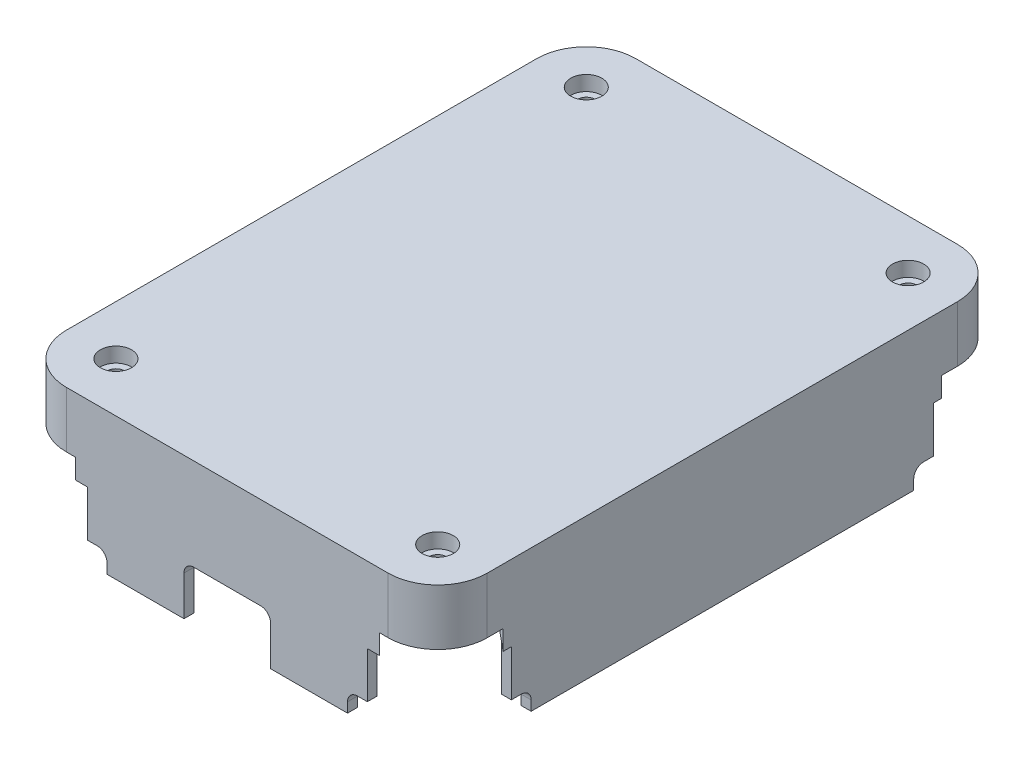
from build123d import *

# Parameters (mm, degrees)
SKETCH1_W               = 107.95
SKETCH1_H               = 146.05
BOSS_EXTRUDE1_DEPTH     = 2.54
SKETCH13_W              = 25.4
SKETCH13_H              = 25.4
BOSS_EXTRUDE4_DEPTH     = 19.431
SKETCH2_R               = 3.302
CUT_EXTRUDE1_DEPTH      = 93.862882849
FILLET1_R               = 12.7
CUT_EXTRUDE13_DEPTH     = 5.08
SKETCH15_R              = 6.35
BOSS_EXTRUDE5_DEPTH     = 11.811
SKETCH23_R              = 2.25
CUT_EXTRUDE14_DEPTH     = 92.934228941
SKETCH24_R              = 4
CUT_EXTRUDE15_DEPTH     = 3.81
MIRROR2_COPY_1_SKETCH_R = 2.25
MIRROR2_COPY_1_DEPTH    = 92.934228941
MIRROR2_COPY_2_SKETCH_R = 4
MIRROR2_COPY_2_DEPTH    = 3.81
FILLET3_R               = 12.7
FILLET4_R               = 1.016
SKETCH27_W              = 71.841582164
SKETCH27_H              = 2.54
SKETCH27_W_2            = 2.54
SKETCH27_H_2            = 108.293882364
BOSS_EXTRUDE6_DEPTH     = 33.782
CUT_EXTRUDE16_DEPTH     = 41.656
CUT_EXTRUDE17_DEPTH     = 136.296492227
CUT_EXTRUDE18_DEPTH     = 160.8849299
CUT_EXTRUDE19_REACH     = 161.885
SKETCH31_W              = 22.225
SKETCH31_H              = 12.7
FILLET5_R               = 2.54


with BuildPart() as part:
    # Sketch1 → Boss-Extrude1 (new body)
    with BuildSketch(Plane(origin=(0, 0, 0), x_dir=(1, 0, 0), z_dir=(0, 1, 0))):
        Rectangle(SKETCH1_W, SKETCH1_H)
    extrude(amount=-BOSS_EXTRUDE1_DEPTH)

    # Sketch13 → Boss-Extrude4 (add)
    with BuildSketch(Plane(origin=(0, 0, 0), x_dir=(1, 0, 0), z_dir=(0, 1, 0))):
        with Locations((41.275, -60.325)):
            Rectangle(SKETCH13_W, SKETCH13_H)
        with Locations((-41.275, -60.325)):
            Rectangle(SKETCH13_W, SKETCH13_H)
        with Locations((-41.275, 60.325)):
            Rectangle(SKETCH13_W, SKETCH13_H)
        with Locations((41.275, 60.325)):
            Rectangle(SKETCH13_W, SKETCH13_H)
    extrude(amount=-BOSS_EXTRUDE4_DEPTH)

    # Sketch2 → Cut-Extrude1 (cut, through all)
    with BuildSketch(Plane(origin=(0, 0, 0), x_dir=(1, 0, 0), z_dir=(0, 1, 0))):
        with Locations(Location((-41.275, 60.325, 0), (0, 0, 270))):
            Circle(SKETCH2_R)
        with Locations(Location((41.275, 60.325, 0), (0, 0, 90))):
            Circle(SKETCH2_R)
        with Locations(Location((41.275, -60.325, 0), (0, 0, 270))):
            Circle(SKETCH2_R)
        with Locations(Location((-41.275, -60.325, 0), (0, 0, 90))):
            Circle(SKETCH2_R)
    extrude(amount=-CUT_EXTRUDE1_DEPTH, mode=Mode.SUBTRACT)

    # Fillet1
    fillet1_edges = [part.edges().sort_by_distance(p)[0] for p in [
        (53.975, -9.7155, 73.025),
        (-53.975, -9.7155, 73.025),
        (-53.975, -9.7155, -73.025),
        (53.975, -9.7155, -73.025),
    ]]
    fillet(fillet1_edges, radius=FILLET1_R)

    # Sketch14 → Cut-Extrude13 (cut)
    with BuildSketch(Plane.XZ.offset(19.431)):
        Polygon((20.692003582, -28.674172721), (6.35, -45.983487389), (139.336989519, -156.172707277), (153.678993101, -138.863392609), align=None)
        Polygon((-20.692003582, -28.674172721), (-6.35, -45.983487389), (-139.336989519, -156.172707277), (-153.678993101, -138.863392609), align=None)
        Polygon((-153.678993101, 138.863392609), (-20.692003582, 28.674172721), (-6.35, 45.983487389), (-139.336989519, 156.172707277), align=None)
        Polygon((20.692003582, 28.674172721), (6.35, 45.983487389), (139.336989519, 156.172707277), (153.678993101, 138.863392609), align=None)
    extrude(amount=-CUT_EXTRUDE13_DEPTH, mode=Mode.SUBTRACT)

    # Sketch15 → Boss-Extrude5 (add)
    with BuildSketch(Plane(origin=(0, 0, 0), x_dir=(1, 0, 0), z_dir=(0, 1, 0))):
        with Locations((-41.275, 60.325)):
            Circle(SKETCH15_R)
        with Locations((41.275, 60.325)):
            Circle(SKETCH15_R)
        with Locations((-41.275, -60.325)):
            Circle(SKETCH15_R)
        with Locations((41.275, -60.325)):
            Circle(SKETCH15_R)
    extrude(amount=-BOSS_EXTRUDE5_DEPTH)

    # Sketch23 → Cut-Extrude14 (cut, through all)
    with BuildSketch(Plane.XZ.offset(14.351)):
        with Locations(Location((-41.275, -60.325, 0), (0, 0, 270))):
            Circle(SKETCH23_R)
    cut_extrude14 = extrude(amount=-CUT_EXTRUDE14_DEPTH, mode=Mode.SUBTRACT)

    # Sketch24 → Cut-Extrude15 (cut)
    with BuildSketch(Plane(origin=(0, 0, 0), x_dir=(1, 0, 0), z_dir=(0, 1, 0))):
        with Locations(Location((-41.275, 60.325, 0), (0, 0, 270))):
            Circle(SKETCH24_R)
    cut_extrude15 = extrude(amount=-CUT_EXTRUDE15_DEPTH, mode=Mode.SUBTRACT)

    # Mirror1: Cut-Extrude14, Cut-Extrude15 across plane
    add(cut_extrude14.mirror(Plane.XY), mode=Mode.SUBTRACT)
    add(cut_extrude15.mirror(Plane.XY), mode=Mode.SUBTRACT)

    # Mirror2: Cut-Extrude14, Cut-Extrude15 across plane
    add(cut_extrude14.mirror(Plane(origin=(0, 0, 0), x_dir=(0, 0, 1), z_dir=(1, 0, 0))), mode=Mode.SUBTRACT)
    add(cut_extrude15.mirror(Plane(origin=(0, 0, 0), x_dir=(0, 0, 1), z_dir=(1, 0, 0))), mode=Mode.SUBTRACT)

    # Mirror2 copy 1 sketch → Mirror2 copy 1 (cut, through all)
    with BuildSketch(Plane(origin=(0, -14.351, 0), x_dir=(-1, 0, 0), z_dir=(0, -1, 0))):
        with Locations(Location((-41.275, -60.325, 0), (0, 0, 270))):
            Circle(MIRROR2_COPY_1_SKETCH_R)
    extrude(amount=-MIRROR2_COPY_1_DEPTH, mode=Mode.SUBTRACT)

    # Mirror2 copy 2 sketch → Mirror2 copy 2 (cut)
    with BuildSketch(Plane(origin=(0, 0, 0), x_dir=(-1, 0, 0), z_dir=(0, 1, 0))):
        with Locations(Location((-41.275, 60.325, 0), (0, 0, 270))):
            Circle(MIRROR2_COPY_2_SKETCH_R)
    extrude(amount=-MIRROR2_COPY_2_DEPTH, mode=Mode.SUBTRACT)

    # Fillet3
    fillet3_edges = [part.edges().sort_by_distance(p)[0] for p in [
        (28.575, -8.4455, -47.625),
        (-28.575, -8.4455, -47.625),
        (-28.575, -8.4455, 47.625),
        (28.575, -8.4455, 47.625),
    ]]
    fillet(fillet3_edges, radius=FILLET3_R)

    # Fillet4
    fillet4_edges = [part.edges().sort_by_distance(p)[0] for p in [
        (41.275, -14.351, -57.023),
        (-41.275, -14.351, -63.627),
        (-41.275, -14.351, 63.627),
        (41.275, -14.351, 57.023),
    ]]
    fillet(fillet4_edges, radius=FILLET4_R)

    # Sketch27 → Boss-Extrude6 (add)
    with BuildSketch(Plane.XZ.offset(2.54)):
        with Locations((0, -71.755)):
            Rectangle(SKETCH27_W, SKETCH27_H)
        with Locations((0, 71.755)):
            Rectangle(SKETCH27_W, SKETCH27_H)
        with Locations((52.705, 0)):
            Rectangle(SKETCH27_W_2, SKETCH27_H_2)
        with Locations((-52.705, 0)):
            Rectangle(SKETCH27_W_2, SKETCH27_H_2)
    extrude(amount=BOSS_EXTRUDE6_DEPTH)

    # Sketch28 → Cut-Extrude16 (cut)
    with BuildSketch(Plane(origin=(0, 0, -73.025), x_dir=(-1, 0, 0), z_dir=(0, 0, -1))):
        with BuildLine():
            Line((-17.526, -36.322), (17.526, -36.322))
            Line((17.526, -36.322), (29.591, -36.322))
            Line((29.591, -36.322), (29.591, -33.782))
            ThreePointArc((29.591, -33.782), (28.847051224, -31.985948776), (27.051, -31.242))
            Line((27.051, -31.242), (19.431, -31.242))
            ThreePointArc((19.431, -31.242), (17.634948776, -30.498051224), (16.891, -28.702))
            Line((16.891, -28.702), (16.891, -21.3995))
            ThreePointArc((16.891, -21.3995), (16.147051224, -19.603448776), (14.351, -18.8595))
            Line((14.351, -18.8595), (-14.351, -18.8595))
            ThreePointArc((-14.351, -18.8595), (-16.147051224, -19.603448776), (-16.891, -21.3995))
            Line((-16.891, -21.3995), (-16.891, -28.702))
            ThreePointArc((-16.891, -28.702), (-17.634948776, -30.498051224), (-19.431, -31.242))
            Line((-19.431, -31.242), (-27.051, -31.242))
            ThreePointArc((-27.051, -31.242), (-28.847051224, -31.985948776), (-29.591, -33.782))
            Line((-29.591, -33.782), (-29.591, -36.322))
            Line((-29.591, -36.322), (-17.526, -36.322))
        make_face()
    extrude(amount=-CUT_EXTRUDE16_DEPTH, mode=Mode.SUBTRACT)

    # Sketch29 → Cut-Extrude17 (cut, through all)
    with BuildSketch(Plane.ZY.offset(53.975)):
        with BuildLine():
            Line((-54.146941182, -36.322), (-49.066941182, -36.322))
            Line((-49.066941182, -36.322), (-49.066941182, -33.782))
            ThreePointArc((-49.066941182, -33.782), (-49.810889958, -31.985948776), (-51.606941182, -31.242))
            Line((-51.606941182, -31.242), (-54.146941182, -31.242))
            Line((-54.146941182, -31.242), (-54.146941182, -36.322))
        make_face()
        with BuildLine():
            Line((49.066941182, -36.322), (49.066941182, -33.782))
            ThreePointArc((49.066941182, -33.782), (49.810889958, -31.985948776), (51.606941182, -31.242))
            Line((51.606941182, -31.242), (54.146941182, -31.242))
            Line((54.146941182, -31.242), (54.146941182, -36.322))
            Line((54.146941182, -36.322), (49.066941182, -36.322))
        make_face()
    extrude(amount=-CUT_EXTRUDE17_DEPTH, mode=Mode.SUBTRACT)

    # Sketch30 → Cut-Extrude18 (cut, through all)
    with BuildSketch(Plane.XY.offset(73.025)):
        with BuildLine():
            Line((-35.920791082, -36.322), (-30.840791082, -36.322))
            Line((-30.840791082, -36.322), (-30.840791082, -33.782))
            ThreePointArc((-30.840791082, -33.782), (-31.584739858, -31.985948776), (-33.380791082, -31.242))
            Line((-33.380791082, -31.242), (-35.920791082, -31.242))
            Line((-35.920791082, -31.242), (-35.920791082, -36.322))
        make_face()
        with BuildLine():
            Line((30.840791082, -36.322), (30.840791082, -33.782))
            ThreePointArc((30.840791082, -33.782), (31.584739858, -31.985948776), (33.380791082, -31.242))
            Line((33.380791082, -31.242), (35.920791082, -31.242))
            Line((35.920791082, -31.242), (35.920791082, -36.322))
            Line((35.920791082, -36.322), (30.840791082, -36.322))
        make_face()
    extrude(amount=-CUT_EXTRUDE18_DEPTH, mode=Mode.SUBTRACT)

    # Sketch31 → Cut-Extrude19 (cut, up to next)
    with BuildSketch(Plane.XY.offset(73.025), mode=Mode.PRIVATE) as cut_extrude19_sk1:
        with Locations((0, -29.972)):
            Rectangle(SKETCH31_W, SKETCH31_H)
    cut_extrude19_tool1 = extrude(cut_extrude19_sk1.sketch, amount=-CUT_EXTRUDE19_REACH, mode=Mode.PRIVATE) & part.part
    add(cut_extrude19_tool1.solids().sort_by_distance((0, -29.972, 73.025))[0], mode=Mode.SUBTRACT)

    # Fillet5
    fillet5_edges = [part.edges().sort_by_distance(p)[0] for p in [
        (-11.1125, -23.622, 71.755),
        (11.1125, -23.622, 71.755),
    ]]
    fillet(fillet5_edges, radius=FILLET5_R)


solid = part.part
